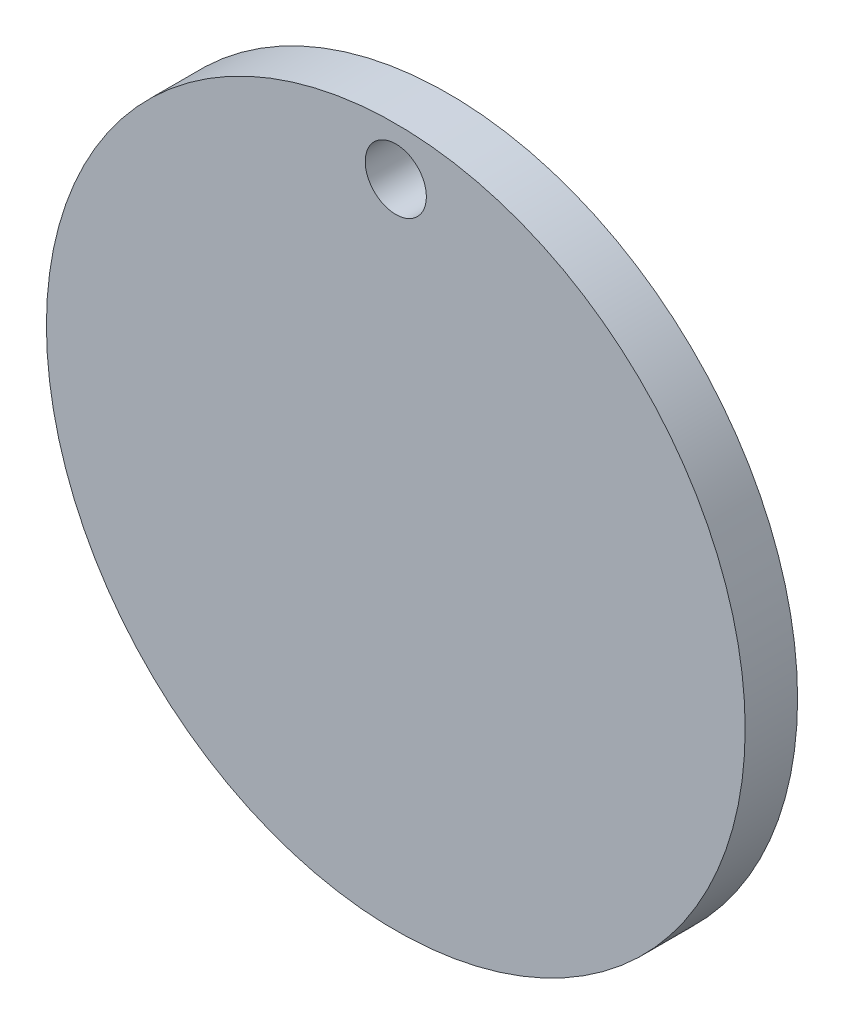
from build123d import *

# Parameters (mm, degrees)
SKETCH_1_R          = 20
EXTRUDE_1_DEPTH     = 3
SKETCH_2_R          = 1.75
CUT_EXTRUDE_1_DEPTH = 3


with BuildPart() as part:
    # 草图1 → 凸台-拉伸1 (new body)
    with BuildSketch(Plane.XY):
        Circle(SKETCH_1_R)
    extrude(amount=EXTRUDE_1_DEPTH)

    # 草图2 → 切除-拉伸1 (cut)
    with BuildSketch(Plane.XY.offset(3)):
        with Locations((0, 17.25)):
            Circle(SKETCH_2_R)
    extrude(amount=-CUT_EXTRUDE_1_DEPTH, mode=Mode.SUBTRACT)


solid = part.part
